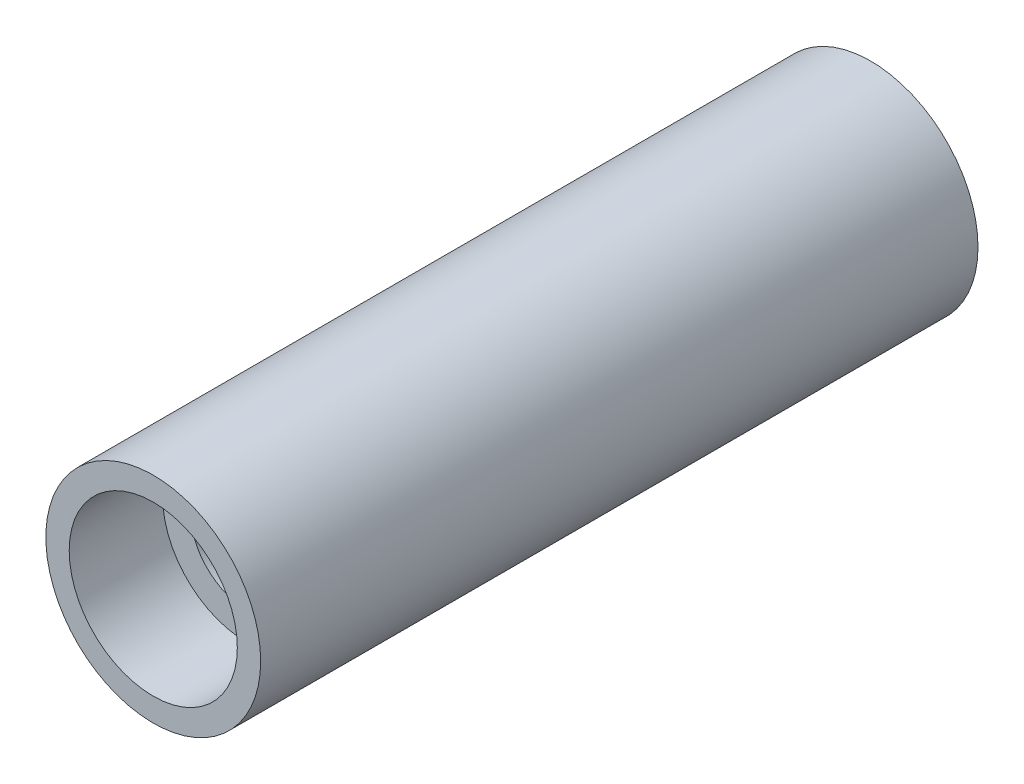
from build123d import *

# Parameters (mm, degrees)
SKETCH2_R           = 5.75
SKETCH2_R_2         = 3
BOSS_EXTRUDE1_DEPTH = 19.2
SKETCH5_W           = 5
SKETCH5_H           = 4.5


with BuildPart() as part:
    # Sketch2 → Boss-Extrude1 (new, symmetric)
    with BuildSketch(Plane.XY):
        Circle(SKETCH2_R)
        Circle(SKETCH2_R_2, mode=Mode.SUBTRACT)
    extrude(amount=BOSS_EXTRUDE1_DEPTH, both=True)

    # Sketch5 → Cut-Revolve1 (revolve, cut)
    with BuildSketch(Plane(origin=(0, 0, 0), x_dir=(0, 0, -1), z_dir=(1, 0, 0)), mode=Mode.PRIVATE) as cut_revolve1_sk:
        with Locations((16.7, 2.25)):
            Rectangle(SKETCH5_W, SKETCH5_H)
        with Locations((-16.7, 2.25)):
            Rectangle(SKETCH5_W, SKETCH5_H)
    revolve(cut_revolve1_sk.sketch.rotate(Axis((0, 0, -19.2), (0, 0, 1)), 90), axis=Axis((0, 0, -19.2), (0, 0, 1)), mode=Mode.SUBTRACT)


solid = part.part
